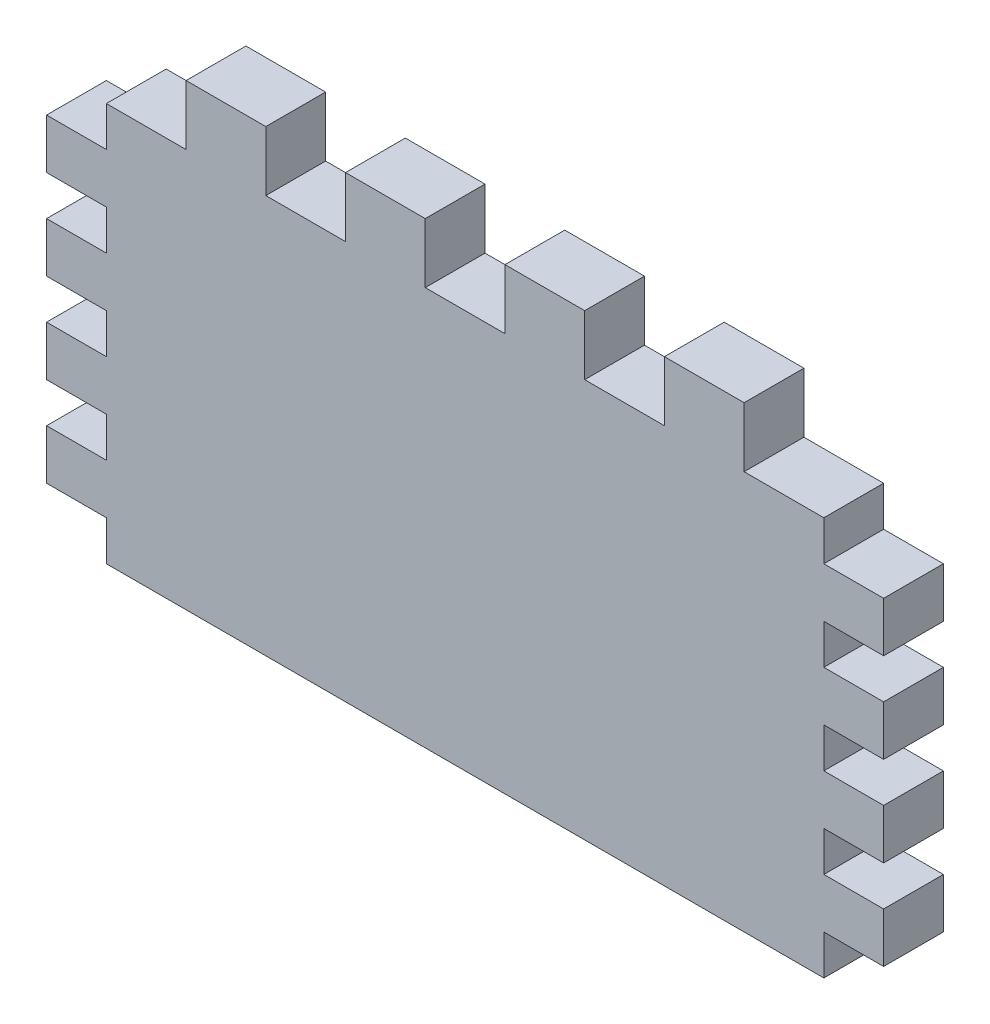
from build123d import *

# Parameters (mm, degrees)
BOSS_EXTRUDE1_DEPTH = 3


with BuildPart() as part:
    # Sketch1 → Boss-Extrude1 (new body)
    with BuildSketch(Plane.XY):
        Polygon((18, 10), (18, 8), (21, 8), (21, 5.5), (18, 5.5), (18, 3.5), (21, 3.5), (21, 1), (18, 1), (18, -1), (21, -1), (21, -3.5), (18, -3.5), (18, -5.5), (21, -5.5), (21, -8), (18, -8), (18, -10), (-18, -10), (-18, -8), (-21, -8), (-21, -5.5), (-18, -5.5), (-18, -3.5), (-21, -3.5), (-21, -1), (-18, -1), (-18, 1), (-21, 1), (-21, 3.5), (-18, 3.5), (-18, 5.5), (-21, 5.5), (-21, 8), (-18, 8), (-18, 10), (-14, 10), (-14, 13), (-10, 13), (-10, 10), (-6, 10), (-6, 13), (-2, 13), (-2, 10), (2, 10), (2, 13), (6, 13), (6, 10), (10, 10), (10, 13), (14, 13), (14, 10), align=None)
    extrude(amount=BOSS_EXTRUDE1_DEPTH)


solid = part.part
